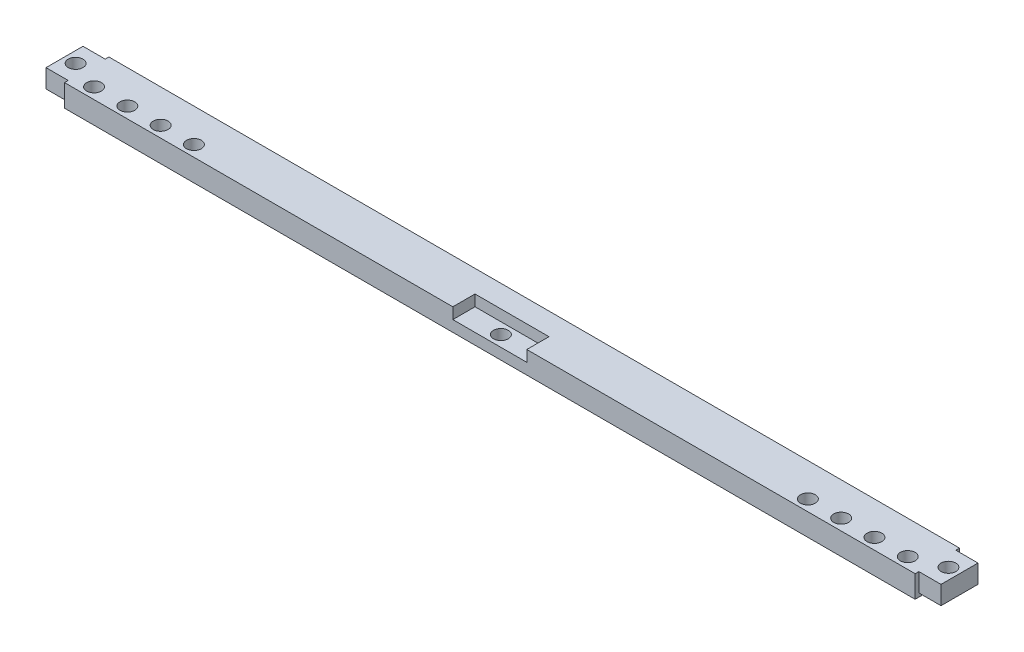
from build123d import *

# Parameters (mm, degrees)
SKETCH1_W           = 614.68
SKETCH1_H           = 30.48
BOSS_EXTRUDE1_DEPTH = 15.24
SKETCH2_W           = 15.24
SKETCH2_H           = 2.54
CUT_EXTRUDE1_DEPTH  = 15.24
SKETCH3_W           = 15.24
SKETCH3_H           = 25.4
CUT_EXTRUDE2_DEPTH  = 2.54
SKETCH4_R           = 5.08
CUT_EXTRUDE3_DEPTH  = 17.78
SKETCH5_W           = 50.8
SKETCH5_H           = 15.24
CUT_EXTRUDE4_DEPTH  = 7.62
SKETCH6_R           = 5.08
CUT_EXTRUDE5_DEPTH  = 12.7
SKETCH7_R           = 5.08
CUT_EXTRUDE6_DEPTH  = 17.78


with BuildPart() as part:
    # Sketch1 → Boss-Extrude1 (new body)
    with BuildSketch(Plane(origin=(0, 0, 0), x_dir=(1, 0, 0), z_dir=(0, 1, 0))):
        Rectangle(SKETCH1_W, SKETCH1_H)
    extrude(amount=BOSS_EXTRUDE1_DEPTH)

    # Sketch2 → Cut-Extrude1 (cut)
    with BuildSketch(Plane(origin=(0, 15.24, 0), x_dir=(1, 0, 0), z_dir=(0, 1, 0))):
        with Locations((-299.72, 13.97)):
            Rectangle(SKETCH2_W, SKETCH2_H)
        with Locations((-299.72, -13.97)):
            Rectangle(SKETCH2_W, SKETCH2_H)
        with Locations((299.72, 13.97)):
            Rectangle(SKETCH2_W, SKETCH2_H)
        with Locations((299.72, -13.97)):
            Rectangle(SKETCH2_W, SKETCH2_H)
    extrude(amount=-CUT_EXTRUDE1_DEPTH, mode=Mode.SUBTRACT)

    # Sketch3 → Cut-Extrude2 (cut)
    with BuildSketch(Plane.XZ):
        with Locations((299.72, 0)):
            Rectangle(SKETCH3_W, SKETCH3_H)
        with Locations((-299.72, 0)):
            Rectangle(SKETCH3_W, SKETCH3_H)
    extrude(amount=-CUT_EXTRUDE2_DEPTH, mode=Mode.SUBTRACT)

    # Sketch4 → Cut-Extrude3 (cut)
    with BuildSketch(Plane(origin=(0, 15.24, 0), x_dir=(1, 0, 0), z_dir=(0, 1, 0))):
        with Locations(Location((-299.72, 0, 0), (0, 0, 270))):
            Circle(SKETCH4_R)
        with Locations(Location((299.72, 0, 0), (0, 0, 270))):
            Circle(SKETCH4_R)
    extrude(amount=-CUT_EXTRUDE3_DEPTH, mode=Mode.SUBTRACT)

    # Sketch5 → Cut-Extrude4 (cut)
    with BuildSketch(Plane(origin=(0, 15.24, 0), x_dir=(1, 0, 0), z_dir=(0, 1, 0))):
        with Locations((0, -7.62)):
            Rectangle(SKETCH5_W, SKETCH5_H)
    extrude(amount=-CUT_EXTRUDE4_DEPTH, mode=Mode.SUBTRACT)

    # Sketch6 → Cut-Extrude5 (cut)
    with BuildSketch(Plane(origin=(0, 7.62, 0), x_dir=(1, 0, 0), z_dir=(0, 1, 0))):
        with Locations(Location((0, -7.62, 0), (0, 0, 270))):
            Circle(SKETCH6_R)
    extrude(amount=-CUT_EXTRUDE5_DEPTH, mode=Mode.SUBTRACT)

    # Sketch7 → Cut-Extrude6 (cut)
    with BuildSketch(Plane(origin=(0, 15.24, 0), x_dir=(1, 0, 0), z_dir=(0, 1, 0))):
        with Locations(Location((-279.4, -7.62, 0), (0, 0, 270))):
            Circle(SKETCH7_R)
        with Locations(Location((-256.54, -7.62, 0), (0, 0, 270))):
            Circle(SKETCH7_R)
        with Locations(Location((-233.68, -7.62, 0), (0, 0, 270))):
            Circle(SKETCH7_R)
        with Locations(Location((-210.82, -7.62, 0), (0, 0, 270))):
            Circle(SKETCH7_R)
        with Locations(Location((279.4, -7.62, 0), (0, 0, 270))):
            Circle(SKETCH7_R)
        with Locations(Location((256.54, -7.62, 0), (0, 0, 270))):
            Circle(SKETCH7_R)
        with Locations(Location((233.68, -7.62, 0), (0, 0, 270))):
            Circle(SKETCH7_R)
        with Locations(Location((210.82, -7.62, 0), (0, 0, 270))):
            Circle(SKETCH7_R)
    extrude(amount=-CUT_EXTRUDE6_DEPTH, mode=Mode.SUBTRACT)


solid = part.part
